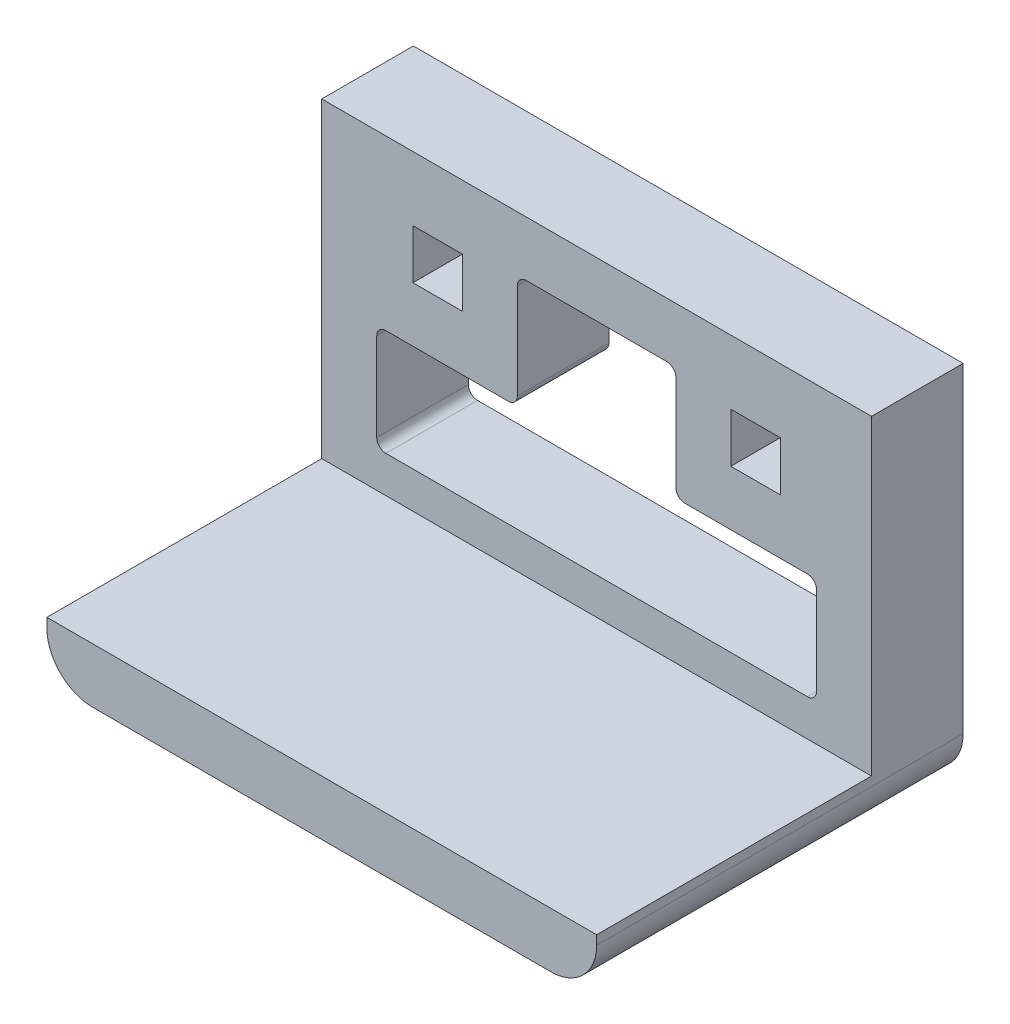
from build123d import *

# Parameters (mm, degrees)
SKETCH1_W           = 40
SKETCH1_H           = 60
BOSS_EXTRUDE1_DEPTH = 10
SKETCH2_W           = 5.4
SKETCH2_H           = 5.4
CUT_EXTRUDE1_DEPTH  = 38.416573868
SKETCH3_W           = 60
SKETCH3_H           = 6
BOSS_EXTRUDE2_DEPTH = 30
CUT_EXTRUDE2_DEPTH  = 47.904157598
FILLET2_R           = 1
FILLET3_R           = 5


with BuildPart() as part:
    # Sketch1 → Boss-Extrude1 (new body)
    with BuildSketch(Plane(origin=(0, 0, 0), x_dir=(0, 1, 0), z_dir=(0, 0, 1))):
        Rectangle(SKETCH1_W, SKETCH1_H)
    extrude(amount=BOSS_EXTRUDE1_DEPTH)

    # Sketch2 → Cut-Extrude1 (cut, through all)
    with BuildSketch(Plane.XY.offset(10)):
        with Locations((-17.35, 10.3)):
            Rectangle(SKETCH2_W, SKETCH2_H)
        with Locations((17.35, 10.3)):
            Rectangle(SKETCH2_W, SKETCH2_H)
    extrude(amount=-CUT_EXTRUDE1_DEPTH, mode=Mode.SUBTRACT)

    # Sketch3 → Boss-Extrude2 (add)
    with BuildSketch(Plane.XY.offset(10)):
        with Locations((0, -17)):
            Rectangle(SKETCH3_W, SKETCH3_H)
    extrude(amount=BOSS_EXTRUDE2_DEPTH)

    # Sketch4 → Cut-Extrude2 (cut, through all)
    with BuildSketch(Plane.XY.offset(10)):
        Polygon((-24, 1.6), (-8.65, 1.6), (-8.65, 14), (8.65, 14), (8.65, 1.6), (24, 1.6), (24, -10), (-24, -10), align=None)
    extrude(amount=-CUT_EXTRUDE2_DEPTH, mode=Mode.SUBTRACT)

    # Fillet2
    fillet2_edges = [part.edges().sort_by_distance(p)[0] for p in [
        (-24, -10, 5),
        (-24, 1.6, 5),
        (-8.65, 1.6, 5),
        (-8.65, 14, 5),
        (8.65, 14, 5),
        (8.65, 1.6, 5),
        (24, 1.6, 5),
        (24, -10, 5),
    ]]
    fillet(fillet2_edges, radius=FILLET2_R)

    # Fillet3
    fillet3_edges = [part.edges().sort_by_distance(p)[0] for p in [
        (30, -20, 20),
        (-30, -20, 20),
    ]]
    fillet(fillet3_edges, radius=FILLET3_R)


solid = part.part
